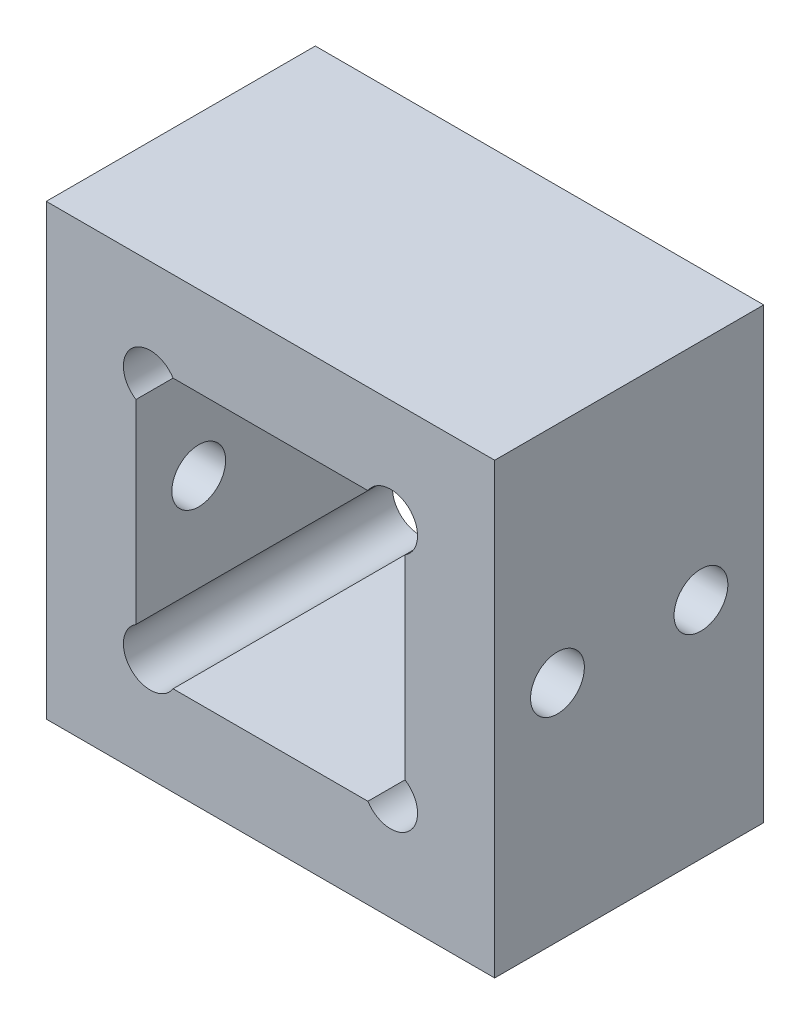
from build123d import *

# Parameters (mm, degrees)
SKETCH_1_W          = 25
SKETCH_1_H          = 25
SKETCH_1_W_2        = 15
SKETCH_1_H_2        = 15
EXTRUDE_1_DEPTH     = 15
SKETCH_2_R          = 1.5
CUT_EXTRUDE_1_DEPTH = 24.184046239
SKETCH_3_R          = 1.5
CUT_EXTRUDE_2_DEPTH = 32.721443851


with BuildPart() as part:
    # 草图1 → 凸台-拉伸1 (new body)
    with BuildSketch(Plane.XY):
        Rectangle(SKETCH_1_W, SKETCH_1_H)
        Rectangle(SKETCH_1_W_2, SKETCH_1_H_2, mode=Mode.SUBTRACT)
    extrude(amount=EXTRUDE_1_DEPTH)

    # 草图2 → 切除-拉伸1 (cut, through all)
    with BuildSketch(Plane.XY.offset(15)):
        with Locations((6.7, 6.7)):
            Circle(SKETCH_2_R)
        with Locations((6.7, -6.7)):
            Circle(SKETCH_2_R)
        with Locations((-6.7, -6.7)):
            Circle(SKETCH_2_R)
        with Locations((-6.7, 6.7)):
            Circle(SKETCH_2_R)
    extrude(amount=-CUT_EXTRUDE_1_DEPTH, mode=Mode.SUBTRACT)

    # 草图3 → 切除-拉伸2 (cut, through all)
    with BuildSketch(Plane(origin=(12.5, 0, 0), x_dir=(0, 0, -1), z_dir=(1, 0, 0))):
        with Locations(Location((-11.5, 0, 0), (0, 0, 90))):
            Circle(SKETCH_3_R)
        with Locations((-3.5, 0)):
            Circle(SKETCH_3_R)
    extrude(amount=-CUT_EXTRUDE_2_DEPTH, mode=Mode.SUBTRACT)


solid = part.part
